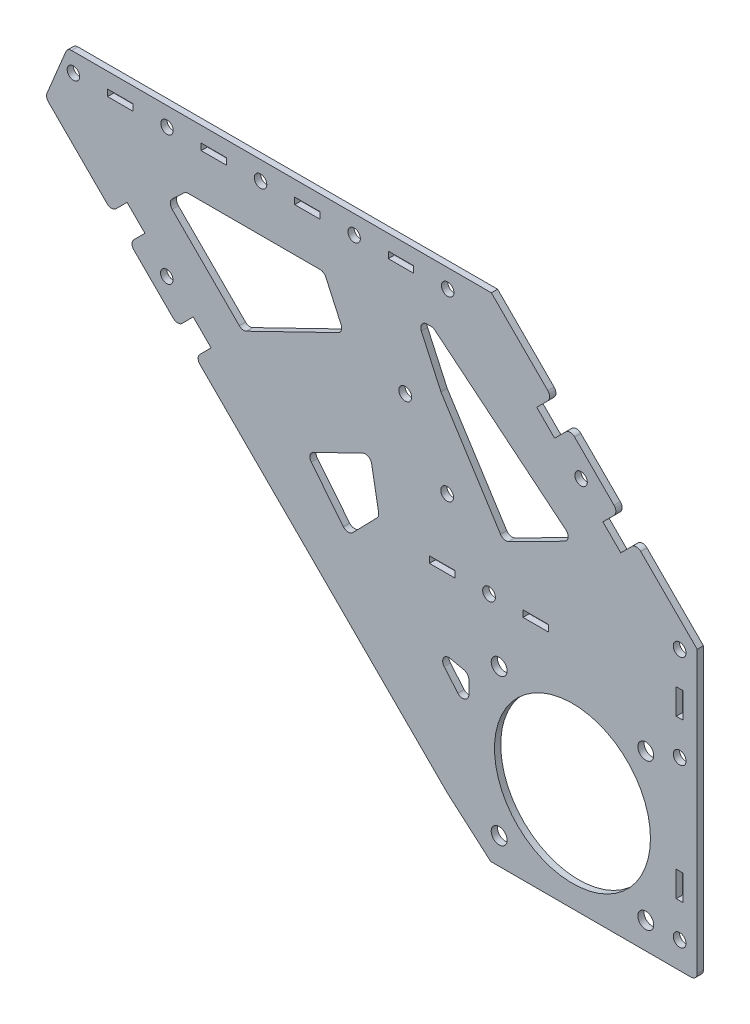
from build123d import *

# Parameters (mm, degrees)
SKETCH_1_R      = 2
SKETCH_1_R_2    = 25
SKETCH_1_R_3    = 2.05
SKETCH_1_R_4    = 2.55
SKETCH_1_W      = 8.1
SKETCH_1_H      = 2.1
SKETCH_1_W_2    = 8.2
SKETCH_1_W_3    = 2.2
SKETCH_1_H_2    = 8.2
EXTRUDE_1_DEPTH = 2
FILLET_2_R      = 2


with BuildPart() as part:
    # 草图1 → 凸台-拉伸1 (new body)
    with BuildSketch(Plane.XY):
        Polygon((7.027428163, -4.999036262), (20.810808237, -16.956988843), (73.227648339, -16.964389058), (87.027428163, -16.964389058), (87.027428163, 75.054738201), (67.497807203, 94.584359161), (63.997628636, 91.084180595), (62.512704395, 89.599256354), (56.785139468, 95.326821282), (58.270063708, 96.811745522), (61.771734574, 100.31043179), (54.027428163, 108.054738201), (46.284614051, 115.797552313), (42.784435485, 112.297373746), (41.299511244, 110.812449505), (35.571946316, 116.540014433), (37.056870557, 118.024938674), (40.557049124, 121.52511724), (21.027428163, 141.054738201), (-114.884210676, 141.054738201), (-121.955278488, 123.983670389), (-100.755816342, 102.784208243), (-97.257364322, 106.282660262), (-95.772440082, 107.767584503), (-90.044875154, 102.040019575), (-91.529799395, 100.555095335), (-95.028251414, 97.056643315), (-87.28543216, 89.313824061), (-79.542612906, 81.571004807), (-76.044160887, 85.069456827), (-74.559236646, 86.554381067), (-68.831671719, 80.82681614), (-70.316595959, 79.341891899), (-73.815047978, 75.84343988), align=None)
        with Locations((-52.972571837, 135.054738201)):
            Circle(SKETCH_1_R, mode=Mode.SUBTRACT)
        with Locations((47.027428163, 15.054738201)):
            Circle(SKETCH_1_R_2, mode=Mode.SUBTRACT)
        with Locations(Location((-22.972571837, 135.054738201, 0), (0, 0, 180))):
            Circle(SKETCH_1_R, mode=Mode.SUBTRACT)
        with Locations((7.027428163, 135.054738201)):
            Circle(SKETCH_1_R, mode=Mode.SUBTRACT)
        with Locations(Location((-112.972571837, 135.054738201, 0), (0, 0, 180))):
            Circle(SKETCH_1_R, mode=Mode.SUBTRACT)
        with Locations((-82.972571837, 135.054738201)):
            Circle(SKETCH_1_R, mode=Mode.SUBTRACT)
        with Locations((49.784787476, 103.812097514)):
            Circle(SKETCH_1_R, mode=Mode.SUBTRACT)
        with Locations((-83.04451802, 93.554738201)):
            Circle(SKETCH_1_R, mode=Mode.SUBTRACT)
        with Locations((20.275835807, 57.054738201)):
            Circle(SKETCH_1_R_3, mode=Mode.SUBTRACT)
        with Locations((-6.58531727, 99.226748532)):
            Circle(SKETCH_1_R_3, mode=Mode.SUBTRACT)
        with Locations((70.527428163, -8.445261799)):
            Circle(SKETCH_1_R_4, mode=Mode.SUBTRACT)
        with Locations((23.527428163, -8.445261799)):
            Circle(SKETCH_1_R_4, mode=Mode.SUBTRACT)
        with Locations((23.527428163, 38.554738201)):
            Circle(SKETCH_1_R_4, mode=Mode.SUBTRACT)
        with Locations((70.527428163, 38.554738201)):
            Circle(SKETCH_1_R_4, mode=Mode.SUBTRACT)
        with Locations((81.392055944, 72.204829046)):
            Circle(SKETCH_1_R_3, mode=Mode.SUBTRACT)
        with Locations((81.392055944, -8.445261799)):
            Circle(SKETCH_1_R_3, mode=Mode.SUBTRACT)
        with Locations((81.392055944, 42.204829046)):
            Circle(SKETCH_1_R_3, mode=Mode.SUBTRACT)
        with Locations((6.845259268, 78.140743367)):
            Circle(SKETCH_1_R_3, mode=Mode.SUBTRACT)
        with Locations((-37.972571837, 135.054738201)):
            Rectangle(SKETCH_1_W, SKETCH_1_H, mode=Mode.SUBTRACT)
        with Locations((-7.972571837, 135.054738201)):
            Rectangle(SKETCH_1_W, SKETCH_1_H, mode=Mode.SUBTRACT)
        with Locations((-97.972571837, 135.054738201)):
            Rectangle(SKETCH_1_W, SKETCH_1_H, mode=Mode.SUBTRACT)
        with Locations((-67.972571837, 135.054738201)):
            Rectangle(SKETCH_1_W, SKETCH_1_H, mode=Mode.SUBTRACT)
        with Locations((5.275835807, 57.054738201)):
            Rectangle(SKETCH_1_W_2, SKETCH_1_H, mode=Mode.SUBTRACT)
        with Locations((35.275835807, 57.054738201)):
            Rectangle(SKETCH_1_W_2, SKETCH_1_H, mode=Mode.SUBTRACT)
        Polygon((-26.317798475, 106.3059132), (-58.783300448, 90.506724064), (-82.786741677, 114.510165293), (-76.96930946, 120.054738201), (-32.606331473, 120.054738201), align=None, mode=Mode.SUBTRACT)
        Polygon((47.299709176, 85.219712632), (24.92619293, 73.952191934), (4.862626833, 105.451990707), (-2.731253041, 122.054738201), (2.37892986, 122.054738201), align=None, mode=Mode.SUBTRACT)
        Polygon((-14.950211349, 60.939664471), (-17.845757969, 77.065019133), (-38.30861977, 67.106860342), (-24.982934729, 50.626518371), align=None, mode=Mode.SUBTRACT)
        Polygon((2.01437662, 34.262984309), (13.802642778, 20.368597473), (13.802642778, 31.594822975), align=None, mode=Mode.SUBTRACT)
        with Locations((81.392055944, 57.204829046)):
            Rectangle(SKETCH_1_W_3, SKETCH_1_H_2, mode=Mode.SUBTRACT)
        with Locations((81.392055944, 6.554738201)):
            Rectangle(SKETCH_1_W_3, SKETCH_1_H_2, mode=Mode.SUBTRACT)
    extrude(amount=EXTRUDE_1_DEPTH)

    # 圆角2
    fillet_2_edges = [part.edges().sort_by_distance(p)[0] for p in [
        (-26.317798475, 106.3059132, 1),
        (-32.606331473, 120.054738201, 1),
        (-76.96930946, 120.054738201, 1),
        (-82.786741677, 114.510165293, 1),
        (-58.783300448, 90.506724064, 1),
        (47.299709176, 85.219712632, 1),
        (2.37892986, 122.054738201, 1),
        (-2.731253041, 122.054738201, 1),
        (24.92619293, 73.952191934, 1),
        (-24.982934729, 50.626518371, 1),
        (-14.950211349, 60.939664471, 1),
        (-17.845757969, 77.065019133, 1),
        (-38.30861977, 67.106860342, 1),
        (13.802642778, 31.594822975, 1),
        (2.01437662, 34.262984309, 1),
        (13.802642778, 20.368597473, 1),
        (40.557049124, 121.52511724, 1),
        (46.284614051, 115.797552313, 1),
        (61.771734574, 100.31043179, 1),
        (67.497807203, 94.584359161, 1),
        (87.027428163, -16.964389058, 1),
        (-73.815047978, 75.84343988, 1),
        (-79.542612906, 81.571004807, 1),
        (-95.028251414, 97.056643315, 1),
        (-100.755816342, 102.784208243, 1),
        (-121.955278488, 123.983670389, 1),
        (-114.884210676, 141.054738201, 1),
    ]]
    fillet(fillet_2_edges, radius=FILLET_2_R)


solid = part.part
